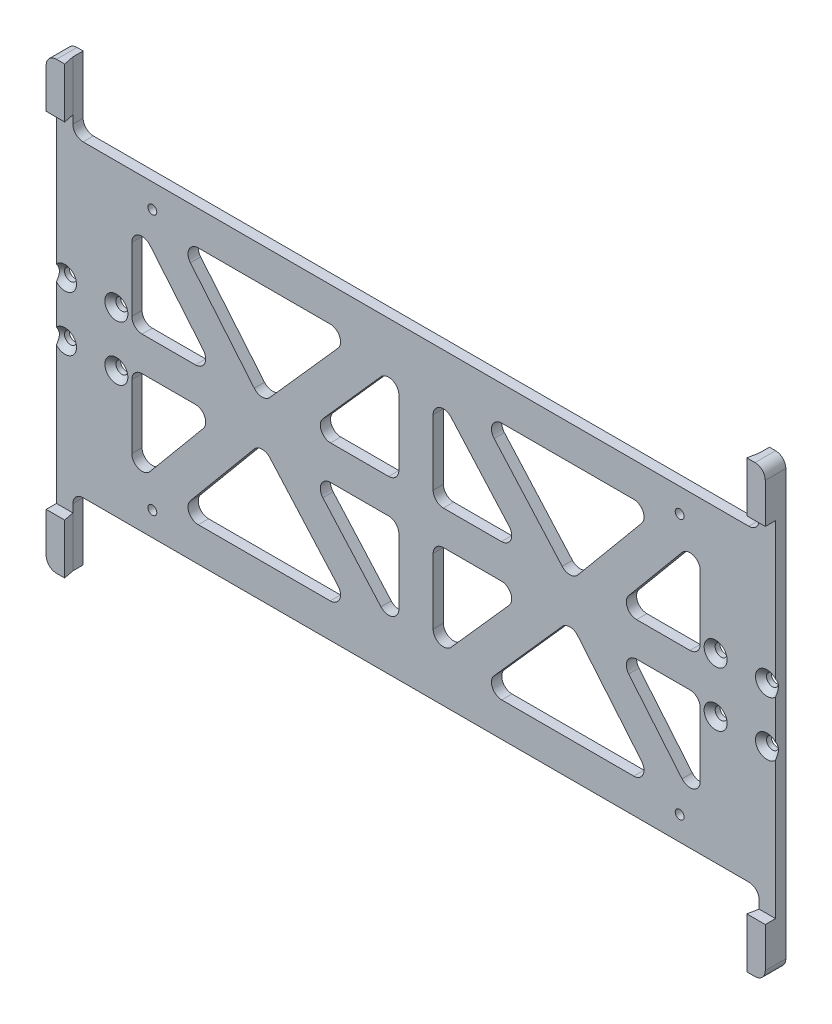
from build123d import *

# Parameters (mm, degrees)
SKETCH_1_R                  = 1.75
SKETCH_1_R_2                = 1.3
EXTRUDE_1_DEPTH             = 3
EXTRUDE_2_DEPTH             = 3
CUT_EXTRUDE_1_DEPTH         = 240.661782814
CUT_EXTRUDE_1_DEPTH_BACK    = 240.661782814
HOLE_WIZARD_M3_5_AT_2_COUNT = 2
HOLE_WIZARD_M3_5_AT_2_PITCH = 16
HOLE_WIZARD_M3_5_AT_3_COUNT = 2
HOLE_WIZARD_M3_5_AT_3_PITCH = 21.931712199
HOLE_WIZARD_M3_5_AT_4_COUNT = 2
HOLE_WIZARD_M3_5_AT_4_PITCH = 15
HOLE_WIZARD_M3_5_AT_5_COUNT = 2
HOLE_WIZARD_M3_5_AT_5_PITCH = 190
HOLE_WIZARD_M3_5_AT_6_COUNT = 2
HOLE_WIZARD_M3_5_AT_6_PITCH = 205.623442243
HOLE_WIZARD_M3_5_AT_7_COUNT = 2
HOLE_WIZARD_M3_5_AT_7_PITCH = 205
HOLE_WIZARD_M3_5_AT_8_COUNT = 2
HOLE_WIZARD_M3_5_AT_8_PITCH = 190.672494083


with BuildPart() as part:
    # 草图1 → 凸台-拉伸1 (new body)
    with BuildSketch(Plane.XY):
        with BuildLine():
            Line((7.8, 0), (202.2, 0))
            ThreePointArc((202.2, 0), (204.321320344, -0.878679656), (205.2, -3))
            Line((205.2, -3), (205.2, -20))
            Line((205.2, -20), (207, -20))
            ThreePointArc((207, -20), (209.121320344, -19.121320344), (210, -17))
            Line((210, -17), (210, 0))
            Line((210, 0), (210, 90))
            Line((210, 90), (210, 107))
            ThreePointArc((210, 107), (209.121320344, 109.121320344), (207, 110))
            Line((207, 110), (205.2, 110))
            Line((205.2, 110), (205.2, 93))
            ThreePointArc((205.2, 93), (204.321320344, 90.878679656), (202.2, 90))
            Line((202.2, 90), (7.8, 90))
            ThreePointArc((7.8, 90), (5.678679656, 90.878679656), (4.8, 93))
            Line((4.8, 93), (4.8, 110))
            Line((4.8, 110), (3, 110))
            ThreePointArc((3, 110), (0.878679656, 109.121320344), (0, 107))
            Line((0, 107), (0, 90))
            Line((0, 90), (0, 0))
            Line((0, 0), (0, -17))
            ThreePointArc((0, -17), (0.878679656, -19.121320344), (3, -20))
            Line((3, -20), (4.8, -20))
            Line((4.8, -20), (4.8, -3))
            ThreePointArc((4.8, -3), (5.678679656, -0.878679656), (7.8, 0))
        make_face()
        with Locations((2.5, 53)):
            Circle(SKETCH_1_R, mode=Mode.SUBTRACT)
        with Locations(Location((17.5, 53, 0), (0, 0, 180))):
            Circle(SKETCH_1_R, mode=Mode.SUBTRACT)
        with Locations((17.5, 37)):
            Circle(SKETCH_1_R, mode=Mode.SUBTRACT)
        with Locations(Location((2.5, 37, 0), (0, 0, 180))):
            Circle(SKETCH_1_R, mode=Mode.SUBTRACT)
        with Locations((207.5, 37)):
            Circle(SKETCH_1_R, mode=Mode.SUBTRACT)
        with Locations(Location((192.5, 37, 0), (0, 0, 180))):
            Circle(SKETCH_1_R, mode=Mode.SUBTRACT)
        with Locations((192.5, 53)):
            Circle(SKETCH_1_R, mode=Mode.SUBTRACT)
        with Locations(Location((207.5, 53, 0), (0, 0, 180))):
            Circle(SKETCH_1_R, mode=Mode.SUBTRACT)
        with Locations((28, 83)):
            Circle(SKETCH_1_R_2, mode=Mode.SUBTRACT)
        with Locations(Location((182, 83, 0), (0, 0, 180))):
            Circle(SKETCH_1_R_2, mode=Mode.SUBTRACT)
        with Locations((182, 7)):
            Circle(SKETCH_1_R_2, mode=Mode.SUBTRACT)
        with Locations(Location((28, 7, 0), (0, 0, 180))):
            Circle(SKETCH_1_R_2, mode=Mode.SUBTRACT)
        with BuildLine():
            Line((22, 71.710263165), (22, 53))
            ThreePointArc((22, 53), (22.878679656, 50.878679656), (25, 50))
            Line((25, 50), (40.583105292, 50))
            ThreePointArc((40.583105292, 50), (43.299697276, 51.727157515), (42.888301086, 54.919914673))
            Line((42.888301086, 54.919914673), (27.305195794, 73.630177837))
            ThreePointArc((27.305195794, 73.630177837), (23.979114939, 74.531219331), (22, 71.710263165))
        make_face(mode=Mode.SUBTRACT)
        with BuildLine():
            Line((39.111698914, 75.080085327), (57.767217115, 52.680849201))
            ThreePointArc((57.767217115, 52.680849201), (60.025200787, 51.601135394), (62.316045524, 52.60925372))
            Line((62.316045524, 52.60925372), (82.19822493, 75.008489847))
            ThreePointArc((82.19822493, 75.008489847), (82.690879074, 78.229932832), (79.954592315, 80))
            Line((79.954592315, 80), (41.416894708, 80))
            ThreePointArc((41.416894708, 80), (38.700302724, 78.272842485), (39.111698914, 75.080085327))
        make_face(mode=Mode.SUBTRACT)
        with BuildLine():
            Line((100, 72.101020514), (100, 53))
            ThreePointArc((100, 53), (99.121320344, 50.878679656), (97, 50))
            Line((97, 50), (80.045407685, 50))
            ThreePointArc((80.045407685, 50), (77.309120926, 51.770067168), (77.80177507, 54.991510153))
            Line((77.80177507, 54.991510153), (94.756367385, 74.092530668))
            ThreePointArc((94.756367385, 74.092530668), (98.065153077, 74.905561283), (100, 72.101020514))
        make_face(mode=Mode.SUBTRACT)
        with BuildLine():
            Line((113, 50), (129.954592315, 50))
            ThreePointArc((129.954592315, 50), (132.690879074, 51.770067168), (132.19822493, 54.991510153))
            Line((132.19822493, 54.991510153), (115.243632615, 74.092530668))
            ThreePointArc((115.243632615, 74.092530668), (111.934846923, 74.905561283), (110, 72.101020514))
            Line((110, 72.101020514), (110, 53))
            ThreePointArc((110, 53), (110.878679656, 50.878679656), (113, 50))
        make_face(mode=Mode.SUBTRACT)
        with BuildLine():
            Line((147.683954476, 52.60925372), (127.80177507, 75.008489847))
            ThreePointArc((127.80177507, 75.008489847), (127.309120926, 78.229932832), (130.045407685, 80))
            Line((130.045407685, 80), (168.583105292, 80))
            ThreePointArc((168.583105292, 80), (171.299697276, 78.272842485), (170.888301086, 75.080085327))
            Line((170.888301086, 75.080085327), (152.232782885, 52.680849201))
            ThreePointArc((152.232782885, 52.680849201), (149.974799213, 51.601135394), (147.683954476, 52.60925372))
        make_face(mode=Mode.SUBTRACT)
        with BuildLine():
            Line((167.111698914, 54.919914673), (182.694804206, 73.630177837))
            ThreePointArc((182.694804206, 73.630177837), (186.020885061, 74.531219331), (188, 71.710263165))
            Line((188, 71.710263165), (188, 53))
            ThreePointArc((188, 53), (187.121320344, 50.878679656), (185, 50))
            Line((185, 50), (169.416894708, 50))
            ThreePointArc((169.416894708, 50), (166.700302724, 51.727157515), (167.111698914, 54.919914673))
        make_face(mode=Mode.SUBTRACT)
        with BuildLine():
            Line((185, 40), (169.416894708, 40))
            ThreePointArc((169.416894708, 40), (166.700302724, 38.272842485), (167.111698914, 35.080085327))
            Line((167.111698914, 35.080085327), (182.694804206, 16.369822163))
            ThreePointArc((182.694804206, 16.369822163), (186.020885061, 15.468780669), (188, 18.289736835))
            Line((188, 18.289736835), (188, 37))
            ThreePointArc((188, 37), (187.121320344, 39.121320344), (185, 40))
        make_face(mode=Mode.SUBTRACT)
        with BuildLine():
            Line((170.888301086, 14.919914673), (152.232782885, 37.319150799))
            ThreePointArc((152.232782885, 37.319150799), (149.974799213, 38.398864606), (147.683954476, 37.39074628))
            Line((147.683954476, 37.39074628), (127.80177507, 14.991510153))
            ThreePointArc((127.80177507, 14.991510153), (127.309120926, 11.770067168), (130.045407685, 10))
            Line((130.045407685, 10), (168.583105292, 10))
            ThreePointArc((168.583105292, 10), (171.299697276, 11.727157515), (170.888301086, 14.919914673))
        make_face(mode=Mode.SUBTRACT)
        with BuildLine():
            Line((113, 40), (129.954592315, 40))
            ThreePointArc((129.954592315, 40), (132.690879074, 38.229932832), (132.19822493, 35.008489847))
            Line((132.19822493, 35.008489847), (115.243632615, 15.907469332))
            ThreePointArc((115.243632615, 15.907469332), (111.934846923, 15.094438717), (110, 17.898979486))
            Line((110, 17.898979486), (110, 37))
            ThreePointArc((110, 37), (110.878679656, 39.121320344), (113, 40))
        make_face(mode=Mode.SUBTRACT)
        with BuildLine():
            Line((97, 40), (80.045407685, 40))
            ThreePointArc((80.045407685, 40), (77.309120926, 38.229932832), (77.80177507, 35.008489847))
            Line((77.80177507, 35.008489847), (94.756367385, 15.907469332))
            ThreePointArc((94.756367385, 15.907469332), (98.065153077, 15.094438717), (100, 17.898979486))
            Line((100, 17.898979486), (100, 37))
            ThreePointArc((100, 37), (99.121320344, 39.121320344), (97, 40))
        make_face(mode=Mode.SUBTRACT)
        with BuildLine():
            Line((62.316045524, 37.39074628), (82.19822493, 14.991510153))
            ThreePointArc((82.19822493, 14.991510153), (82.690879074, 11.770067168), (79.954592315, 10))
            Line((79.954592315, 10), (41.416894708, 10))
            ThreePointArc((41.416894708, 10), (38.700302724, 11.727157515), (39.111698914, 14.919914673))
            Line((39.111698914, 14.919914673), (57.767217115, 37.319150799))
            ThreePointArc((57.767217115, 37.319150799), (60.025200787, 38.398864606), (62.316045524, 37.39074628))
        make_face(mode=Mode.SUBTRACT)
        with BuildLine():
            Line((42.888301086, 35.080085327), (27.305195794, 16.369822163))
            ThreePointArc((27.305195794, 16.369822163), (23.979114939, 15.468780669), (22, 18.289736835))
            Line((22, 18.289736835), (22, 37))
            ThreePointArc((22, 37), (22.878679656, 39.121320344), (25, 40))
            Line((25, 40), (40.583105292, 40))
            ThreePointArc((40.583105292, 40), (43.299697276, 38.272842485), (42.888301086, 35.080085327))
        make_face(mode=Mode.SUBTRACT)
    extrude(amount=EXTRUDE_1_DEPTH)

    # 草图2 → 凸台-拉伸2 (add)
    with BuildSketch(Plane.XY.offset(3)):
        with BuildLine():
            Line((3, 110), (5.4, 110))
            Line((5.4, 110), (5.4, 95.333300228))
            Line((5.4, 95.333300228), (0, 95.333300228))
            Line((0, 95.333300228), (0, 107))
            ThreePointArc((0, 107), (0.878679656, 109.121320344), (3, 110))
        make_face()
        with BuildLine():
            Line((204.6, 95.333300228), (204.6, 110))
            Line((204.6, 110), (207, 110))
            ThreePointArc((207, 110), (209.121320344, 109.121320344), (210, 107))
            Line((210, 107), (210, 95.333300228))
            Line((210, 95.333300228), (204.6, 95.333300228))
        make_face()
        with BuildLine():
            Line((207, -20), (204.6, -20))
            Line((204.6, -20), (204.6, -5.333300228))
            Line((204.6, -5.333300228), (210, -5.333300228))
            Line((210, -5.333300228), (210, -17))
            ThreePointArc((210, -17), (209.121320344, -19.121320344), (207, -20))
        make_face()
        with BuildLine():
            Line((5.4, -5.333300228), (5.4, -20))
            Line((5.4, -20), (3, -20))
            ThreePointArc((3, -20), (0.878679656, -19.121320344), (0, -17))
            Line((0, -17), (0, -5.333300228))
            Line((0, -5.333300228), (5.4, -5.333300228))
        make_face()
    extrude(amount=EXTRUDE_2_DEPTH)

    # 草图3 → 切除-拉伸1 (cut, two sides: drawn at the far end of the back side and taken through both)
    with BuildSketch(Plane.XZ.offset(-95.333300228).offset(-CUT_EXTRUDE_1_DEPTH_BACK)):
        Polygon((4.8, 3), (5.4, 6), (5.4, 3), align=None)
        Polygon((204.6, 3), (204.6, 6), (205.2, 3), align=None)
    extrude(amount=CUT_EXTRUDE_1_DEPTH + CUT_EXTRUDE_1_DEPTH_BACK, mode=Mode.SUBTRACT)

    # 草图11 → M3 六角凹锥坑螺钉的锥形沉头孔5 (revolve, cut)
    with BuildSketch(Plane(origin=(2.5, 53, 3), x_dir=(0, -1, 0), z_dir=(1, 0, 0))):
        Polygon((0, 0), (0, 3), (1.7, 3), (1.7, 1.66), (3.36, 0), align=None)
    hole_wizard_m3_5 = revolve(axis=Axis((2.5, 53, 9.35), (0, 0, -1)), mode=Mode.SUBTRACT)

    # M3 六角凹锥坑螺钉的锥形沉头孔5 at 2: M3 六角凹锥坑螺钉的锥形沉头孔5 ×2
    with Locations(*[(0, -i * HOLE_WIZARD_M3_5_AT_2_PITCH, 0) for i in range(1, HOLE_WIZARD_M3_5_AT_2_COUNT)]):
        add(hole_wizard_m3_5, mode=Mode.SUBTRACT)

    # M3 六角凹锥坑螺钉的锥形沉头孔5 at 3: M3 六角凹锥坑螺钉的锥形沉头孔5 ×2
    with Locations(*[Vector(0.6839411288813297, -0.7295372041400852, 0) * (i * HOLE_WIZARD_M3_5_AT_3_PITCH) for i in range(1, HOLE_WIZARD_M3_5_AT_3_COUNT)]):
        add(hole_wizard_m3_5, mode=Mode.SUBTRACT)

    # M3 六角凹锥坑螺钉的锥形沉头孔5 at 4: M3 六角凹锥坑螺钉的锥形沉头孔5 ×2
    with Locations(*[(i * HOLE_WIZARD_M3_5_AT_4_PITCH, 0, 0) for i in range(1, HOLE_WIZARD_M3_5_AT_4_COUNT)]):
        add(hole_wizard_m3_5, mode=Mode.SUBTRACT)

    # M3 六角凹锥坑螺钉的锥形沉头孔5 at 5: M3 六角凹锥坑螺钉的锥形沉头孔5 ×2
    with Locations(*[(i * HOLE_WIZARD_M3_5_AT_5_PITCH, 0, 0) for i in range(1, HOLE_WIZARD_M3_5_AT_5_COUNT)]):
        add(hole_wizard_m3_5, mode=Mode.SUBTRACT)

    # M3 六角凹锥坑螺钉的锥形沉头孔5 at 6: M3 六角凹锥坑螺钉的锥形沉头孔5 ×2
    with Locations(*[Vector(0.9969680390691945, -0.07781213963466896, 0) * (i * HOLE_WIZARD_M3_5_AT_6_PITCH) for i in range(1, HOLE_WIZARD_M3_5_AT_6_COUNT)]):
        add(hole_wizard_m3_5, mode=Mode.SUBTRACT)

    # M3 六角凹锥坑螺钉的锥形沉头孔5 at 7: M3 六角凹锥坑螺钉的锥形沉头孔5 ×2
    with Locations(*[(i * HOLE_WIZARD_M3_5_AT_7_PITCH, 0, 0) for i in range(1, HOLE_WIZARD_M3_5_AT_7_COUNT)]):
        add(hole_wizard_m3_5, mode=Mode.SUBTRACT)

    # M3 六角凹锥坑螺钉的锥形沉头孔5 at 8: M3 六角凹锥坑螺钉的锥形沉头孔5 ×2
    with Locations(*[Vector(0.9964730409245756, -0.0839135192357539, 0) * (i * HOLE_WIZARD_M3_5_AT_8_PITCH) for i in range(1, HOLE_WIZARD_M3_5_AT_8_COUNT)]):
        add(hole_wizard_m3_5, mode=Mode.SUBTRACT)


solid = part.part
